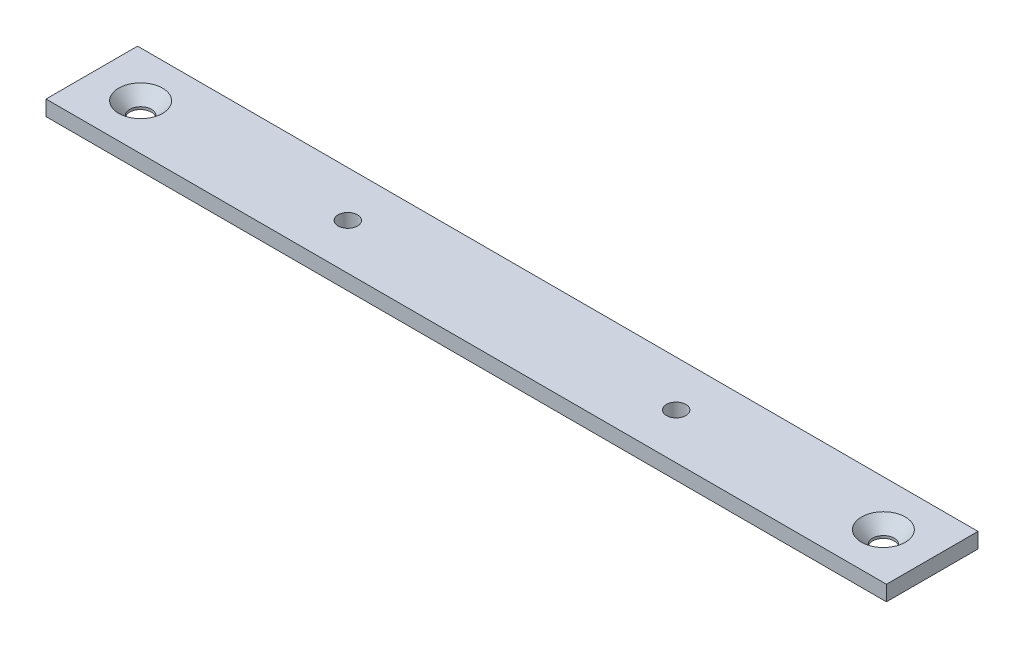
from build123d import *

# Parameters (mm, degrees)
SKETCH1_W                                     = 174.879
SKETCH1_H                                     = 19.05
BOSS_EXTRUDE1_DEPTH                           = 3.175
F_10_32_TAPPED_HOLE1_D                        = 4.0386
F_10_32_TAPPED_HOLE1_DEPTH                    = 11.938
F_10_32_TAPPED_HOLE1_TIP                      = 1.213317848
CSK_FOR_8_FLAT_HEAD_SOCKET_CAP_SCREW1_A_COUNT = 2
CSK_FOR_8_FLAT_HEAD_SOCKET_CAP_SCREW1_A_PITCH = 154.559


with BuildPart() as part:
    # Sketch1 → Boss-Extrude1 (new body)
    with BuildSketch(Plane(origin=(0, 0, 0), x_dir=(1, 0, 0), z_dir=(0, 1, 0))):
        Rectangle(SKETCH1_W, SKETCH1_H)
    extrude(amount=BOSS_EXTRUDE1_DEPTH)

    # #10-32 Tapped Hole1
    with Locations(Plane(origin=(0, 3.175, 0), x_dir=(-1, 0, 0), z_dir=(0, 1, 0))):
        with Locations((34.163, 0), (-34.163, 0)):
            Hole(F_10_32_TAPPED_HOLE1_D / 2, depth=F_10_32_TAPPED_HOLE1_DEPTH)
            with Locations((0, 0, -(F_10_32_TAPPED_HOLE1_DEPTH + F_10_32_TAPPED_HOLE1_TIP / 2))):  # 118° drill point
                Cone(0, F_10_32_TAPPED_HOLE1_D / 2, F_10_32_TAPPED_HOLE1_TIP, mode=Mode.SUBTRACT)

    # Sketch10 → CSK for #8 Flat Head Socket Cap Screw1 (revolve, cut)
    with BuildSketch(Plane(origin=(-77.2795, 3.175, 0), x_dir=(0, 0, 1), z_dir=(1, 0, 0))):
        Polygon((0, 0), (0, 3.175), (2.2479, 3.175), (2.2479, 2.658961536), (4.5593, 0), align=None)
    csk_for_8_flat_head_socket_cap_screw1 = revolve(axis=Axis((-77.2795, 9.525, 0), (0, -1, 0)), mode=Mode.SUBTRACT)

    # CSK for #8 Flat Head Socket Cap Screw1 a: CSK for #8 Flat Head Socket Cap Screw1 ×2
    with Locations(*[(i * CSK_FOR_8_FLAT_HEAD_SOCKET_CAP_SCREW1_A_PITCH, 0, 0) for i in range(1, CSK_FOR_8_FLAT_HEAD_SOCKET_CAP_SCREW1_A_COUNT)]):
        add(csk_for_8_flat_head_socket_cap_screw1, mode=Mode.SUBTRACT)


solid = part.part
